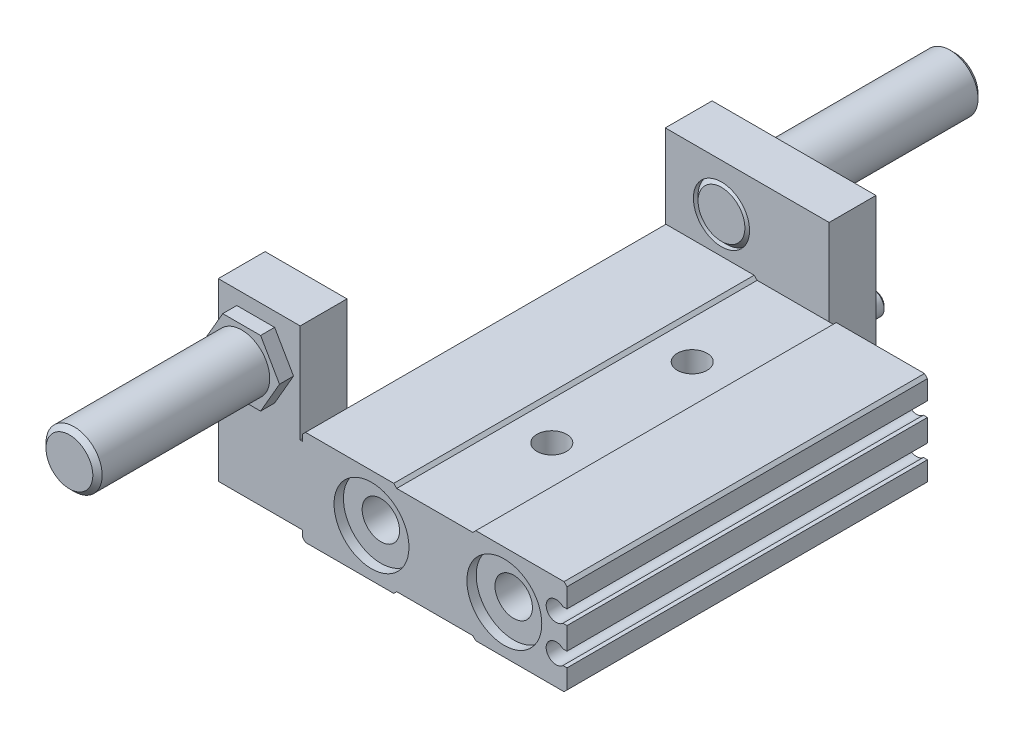
from build123d import *

# Parameters (mm, degrees)
BASE_EXTRUDE_START                = -77
BASE_EXTRUDE_DEPTH                = 77
SKETCH2_R                         = 8
CUT_EXTRUDE1_DEPTH                = 75.7
SKETCH4_R                         = 8
BOSS_EXTRUDE1_DEPTH               = 10
CUT_EXTRUDE3_REACH                = 82.789
SKETCH19_R                        = 4
F_1_4_20_TAPPED_HOLE1_D           = 5.1054
F_1_4_20_TAPPED_HOLE1_DEPTH       = 26.162
F_1_4_20_TAPPED_HOLE1_CBORE_D     = 6.35
F_1_4_20_TAPPED_HOLE1_CBORE_DEPTH = 19.812
F_1_4_20_TAPPED_HOLE1_TIP         = 1.533816902
F_8_32_TAPPED_HOLE1_D             = 3.4544
F_8_32_TAPPED_HOLE1_DEPTH         = 10.8204
F_8_32_TAPPED_HOLE1_CBORE_D       = 4.1656
F_8_32_TAPPED_HOLE1_CBORE_DEPTH   = 6.858
F_8_32_TAPPED_HOLE1_TIP           = 1.037806461
HOLE1_D                           = 5
HOLE1_DEPTH                       = 4
CUT_EXTRUDE4_DEPTH                = 4
F_10_32_TAPPED_HOLE1_D            = 4.0386
F_10_32_TAPPED_HOLE1_DEPTH        = 13.6144
F_10_32_TAPPED_HOLE1_CBORE_D      = 4.826
F_10_32_TAPPED_HOLE1_CBORE_DEPTH  = 9.652
F_10_32_TAPPED_HOLE1_TIP          = 1.213317848
SKETCH30_W                        = 35
SKETCH30_H                        = 37
BOSS_EXTRUDE2_DEPTH               = 10
BOSS_EXTRUDE3_DEPTH               = 3
SKETCH35_R                        = 2.5
BOSS_EXTRUDE5_DEPTH               = 3
CHAMFER2_SIZE                     = 0.5
BOSS_EXTRUDE6_DEPTH               = 10
BOSS_EXTRUDE7_DEPTH               = 3
CUT_EXTRUDE7_REACH                = 109.959
SKETCH38_R                        = 6
CUT_EXTRUDE8_REACH                = 142.905
SKETCH46_R                        = 6
CHAMFER3_SIZE                     = 1


with BuildPart() as part:
    # Sketch1 → Base-Extrude (new body)
    with BuildSketch(Plane(origin=(0, 0, 51.15), x_dir=(-1, 0, 0), z_dir=(0, 0, 1)).offset(BASE_EXTRUDE_START)):
        with BuildLine():
            Line((27.615, 10.1854), (28.25, 9.5504))
            Line((28.25, 9.5504), (28.25, -9.5504))
            Line((28.25, -9.5504), (27.615, -10.1854))
            Line((27.615, -10.1854), (8.763, -10.1854))
            Line((8.763, -10.1854), (8.128, -9.5504))
            Line((8.128, -9.5504), (-8.128, -9.5504))
            Line((-8.128, -9.5504), (-8.763, -10.1854))
            Line((-8.763, -10.1854), (-27.615, -10.1854))
            Line((-27.615, -10.1854), (-28.25, -9.5504))
            Line((-28.25, -9.5504), (-28.25, -5.4483))
            Line((-28.25, -5.4483), (-27.384444989, -5.4483))
            ThreePointArc((-27.384444989, -5.4483), (-23.801775541, -3.9116), (-27.384444989, -2.3749))
            Line((-27.384444989, -2.3749), (-28.25, -2.3749))
            Line((-28.25, -2.3749), (-28.25, 2.3749))
            Line((-28.25, 2.3749), (-27.384444989, 2.3749))
            ThreePointArc((-27.384444989, 2.3749), (-23.801775541, 3.9116), (-27.384444989, 5.4483))
            Line((-27.384444989, 5.4483), (-28.25, 5.4483))
            Line((-28.25, 5.4483), (-28.25, 9.5504))
            Line((-28.25, 9.5504), (-27.615, 10.1854))
            Line((-27.615, 10.1854), (-8.763, 10.1854))
            Line((-8.763, 10.1854), (-8.128, 9.5504))
            Line((-8.128, 9.5504), (8.128, 9.5504))
            Line((8.128, 9.5504), (8.763, 10.1854))
            Line((8.763, 10.1854), (27.615, 10.1854))
        make_face()
    extrude(amount=BASE_EXTRUDE_DEPTH)

    # Sketch2 → Cut-Extrude1 (cut)
    with BuildSketch(Plane(origin=(0, 0, 51.15), x_dir=(-1, 0, 0), z_dir=(0, 0, -1))):
        with Locations(Location((-14.859, 0, 0), (0, 0, 180))):
            Circle(SKETCH2_R)
        with Locations(Location((13.5128, 0, 0), (0, 0, 180))):
            Circle(SKETCH2_R)
    extrude(amount=CUT_EXTRUDE1_DEPTH, mode=Mode.SUBTRACT)

    # Sketch4 → Boss-Extrude1 (add)
    with BuildSketch(Plane.XY.offset(49.15)):
        with Locations((14.859, 0)):
            Circle(SKETCH4_R)
        with Locations((-13.5128, 0)):
            Circle(SKETCH4_R)
    extrude(amount=-BOSS_EXTRUDE1_DEPTH)

    # Sketch19 → Cut-Extrude3 (cut, up to next)
    with BuildSketch(Plane.XY.offset(49.15), mode=Mode.PRIVATE) as cut_extrude3_sk1:
        with Locations((14.859, 0)):
            Circle(SKETCH19_R)
    cut_extrude3_tool1 = extrude(cut_extrude3_sk1.sketch, amount=-CUT_EXTRUDE3_REACH, mode=Mode.PRIVATE) & part.part
    # Sketch19 → Cut-Extrude3 (cut, up to next)
    with BuildSketch(Plane.XY.offset(49.15), mode=Mode.PRIVATE) as cut_extrude3_sk2:
        with Locations((-13.5128, 0)):
            Circle(SKETCH19_R)
    cut_extrude3_tool2 = extrude(cut_extrude3_sk2.sketch, amount=-CUT_EXTRUDE3_REACH, mode=Mode.PRIVATE) & part.part
    add(cut_extrude3_tool1.solids().sort_by_distance((14.859, 0, 49.15))[0], mode=Mode.SUBTRACT)
    add(cut_extrude3_tool2.solids().sort_by_distance((-13.5128, 0, 49.15))[0], mode=Mode.SUBTRACT)

    # 1/4-20 Tapped Hole1
    with Locations(Plane.XZ.offset(9.5504)):
        with Locations((0, 26.15), (0, -3.85)):
            CounterBoreHole(F_1_4_20_TAPPED_HOLE1_D / 2, F_1_4_20_TAPPED_HOLE1_CBORE_D / 2, F_1_4_20_TAPPED_HOLE1_CBORE_DEPTH, depth=F_1_4_20_TAPPED_HOLE1_DEPTH)
            with Locations((0, 0, -(F_1_4_20_TAPPED_HOLE1_DEPTH + F_1_4_20_TAPPED_HOLE1_TIP / 2))):  # 118° drill point
                Cone(0, F_1_4_20_TAPPED_HOLE1_D / 2, F_1_4_20_TAPPED_HOLE1_TIP, mode=Mode.SUBTRACT)

    # #8-32 Tapped Hole1
    with Locations(Plane(origin=(0, 0, -25.85), x_dir=(-1, 0, 0), z_dir=(0, 0, -1))):
        with Locations((25, -5.6854), (25, 5.3146), (-4, -5.6854), (-4, 5.3146)):
            CounterBoreHole(F_8_32_TAPPED_HOLE1_D / 2, F_8_32_TAPPED_HOLE1_CBORE_D / 2, F_8_32_TAPPED_HOLE1_CBORE_DEPTH, depth=F_8_32_TAPPED_HOLE1_DEPTH)
            with Locations((0, 0, -(F_8_32_TAPPED_HOLE1_DEPTH + F_8_32_TAPPED_HOLE1_TIP / 2))):  # 118° drill point
                Cone(0, F_8_32_TAPPED_HOLE1_D / 2, F_8_32_TAPPED_HOLE1_TIP, mode=Mode.SUBTRACT)

    # Hole1
    with Locations(Plane.XZ.offset(10.1854)):
        with Locations((-24, 36.15)):
            Hole(HOLE1_D / 2, depth=HOLE1_DEPTH)

    # Sketch27 → Cut-Extrude4 (cut)
    with BuildSketch(Plane.XZ.offset(10.1854)):
        with BuildLine():
            Line((-26.5, 1.65), (-26.5, 0.65))
            ThreePointArc((-26.5, 0.65), (-24, -1.85), (-21.5, 0.65))
            Line((-21.5, 0.65), (-21.5, 1.65))
            ThreePointArc((-21.5, 1.65), (-24, 4.15), (-26.5, 1.65))
        make_face()
    extrude(amount=-CUT_EXTRUDE4_DEPTH, mode=Mode.SUBTRACT)

    # #10-32 Tapped Hole1
    with Locations(Plane.ZY.offset(28.25)):
        with Locations((30.15, -0.1854), (-21.05, -0.1854)):
            CounterBoreHole(F_10_32_TAPPED_HOLE1_D / 2, F_10_32_TAPPED_HOLE1_CBORE_D / 2, F_10_32_TAPPED_HOLE1_CBORE_DEPTH, depth=F_10_32_TAPPED_HOLE1_DEPTH)
            with Locations((0, 0, -(F_10_32_TAPPED_HOLE1_DEPTH + F_10_32_TAPPED_HOLE1_TIP / 2))):  # 118° drill point
                Cone(0, F_10_32_TAPPED_HOLE1_D / 2, F_10_32_TAPPED_HOLE1_TIP, mode=Mode.SUBTRACT)

    # Sketch30 → Boss-Extrude2 (add)
    with BuildSketch(Plane(origin=(0, 0, -25.85), x_dir=(-1, 0, 0), z_dir=(0, 0, -1))):
        with Locations((10.25, 9.4496)):
            Rectangle(SKETCH30_W, SKETCH30_H)
    extrude(amount=BOSS_EXTRUDE2_DEPTH)

    # Sketch31 → Boss-Extrude3 (add)
    with BuildSketch(Plane(origin=(0, 0, -35.85), x_dir=(-1, 0, 0), z_dir=(0, 0, -1))):
        Polygon((23.832903769, 17.9496), (19.791451884, 24.9496), (11.708548116, 24.9496), (7.667096231, 17.9496), (11.708548116, 10.9496), (19.791451884, 10.9496), align=None)
    extrude(amount=BOSS_EXTRUDE3_DEPTH)

    # Sketch35 → Boss-Extrude5 (add)
    with BuildSketch(Plane(origin=(0, 0, -35.85), x_dir=(-1, 0, 0), z_dir=(0, 0, -1))):
        with Locations((25, 5.3146)):
            Circle(SKETCH35_R)
        with Locations((-4, 5.3146)):
            Circle(SKETCH35_R)
        with Locations((-4, -5.6854)):
            Circle(SKETCH35_R)
        with Locations((25, -5.6854)):
            Circle(SKETCH35_R)
    extrude(amount=BOSS_EXTRUDE5_DEPTH)

    # Chamfer2
    chamfer2_edges = [part.edges().sort_by_distance(p)[0] for p in [
        (-22.5, 5.3146, -38.85),
        (6.5, 5.3146, -38.85),
        (6.5, -5.6854, -38.85),
        (-22.5, -5.6854, -38.85),
    ]]
    chamfer(chamfer2_edges, length=CHAMFER2_SIZE)

    # Sketch36 → Boss-Extrude6 (add)
    with BuildSketch(Plane.XY.offset(41.15)):
        Polygon((-28.75, 29.3146), (-28.75, 8.1854), (-28.25, 8.1854), (-28.25, -8.1854), (-46.25, -8.1854), (-46.25, 29.3146), align=None)
    extrude(amount=BOSS_EXTRUDE6_DEPTH)

    # Sketch37 → Boss-Extrude7 (add)
    with BuildSketch(Plane.XY.offset(51.15)):
        Polygon((-34.208548116, 26.3146), (-42.291451884, 26.3146), (-46.332903769, 19.3146), (-42.291451884, 12.3146), (-34.208548116, 12.3146), (-30.167096231, 19.3146), align=None)
    extrude(amount=BOSS_EXTRUDE7_DEPTH)

    # Sketch38 → Cut-Extrude7 (cut, up to next)
    with BuildSketch(Plane.XY.offset(54.15), mode=Mode.PRIVATE) as cut_extrude7_sk1:
        with Locations((-38.25, 19.3146)):
            Circle(SKETCH38_R)
    cut_extrude7_tool1 = extrude(cut_extrude7_sk1.sketch, amount=-CUT_EXTRUDE7_REACH, mode=Mode.PRIVATE) & part.part
    add(cut_extrude7_tool1.solids().sort_by_distance((-38.25, 19.3146, 54.15))[0], mode=Mode.SUBTRACT)

    # Sketch44 → Boss-Revolve1 (revolve)
    with BuildSketch(Plane(origin=(0, 19.3146, 0), x_dir=(-1, 0, 0), z_dir=(0, 1, 0)), mode=Mode.PRIVATE) as boss_revolve1_sk:
        Polygon((38.25, 90.95), (44.25, 90.95), (44.25, 42.15), (43.25, 41.15), (38.25, 41.15), align=None)
    revolve(boss_revolve1_sk.sketch.rotate(Axis((-38.25, 19.3146, 54.15), (0, 0, -1)), 180), axis=Axis((-38.25, 19.3146, 54.15), (0, 0, -1)))

    # Sketch46 → Cut-Extrude8 (cut, up to next)
    with BuildSketch(Plane(origin=(0, 0, -38.85), x_dir=(-1, 0, 0), z_dir=(0, 0, -1)), mode=Mode.PRIVATE) as cut_extrude8_sk1:
        with Locations((15.75, 17.9496)):
            Circle(SKETCH46_R)
    cut_extrude8_tool1 = extrude(cut_extrude8_sk1.sketch, amount=-CUT_EXTRUDE8_REACH, mode=Mode.PRIVATE) & part.part
    add(cut_extrude8_tool1.solids().sort_by_distance((-15.75, 17.9496, -38.85))[0], mode=Mode.SUBTRACT)

    # Sketch47 → Boss-Revolve2 (revolve)
    with BuildSketch(Plane(origin=(0, 17.9496, 0), x_dir=(-1, 0, 0), z_dir=(0, 1, 0))):
        Polygon((20.75, -25.85), (15.75, -25.85), (15.75, -75.65), (21.75, -75.65), (21.75, -26.85), align=None)
    revolve(axis=Axis((-15.75, 17.9496, -25.85), (0, 0, -1)))

    # Chamfer3
    chamfer3_edges = [part.edges().sort_by_distance(p)[0] for p in [
        (-44.25, 19.3146, 90.95),
        (-9.75, 17.9496, -75.65),
    ]]
    chamfer(chamfer3_edges, length=CHAMFER3_SIZE)


solid = part.part
